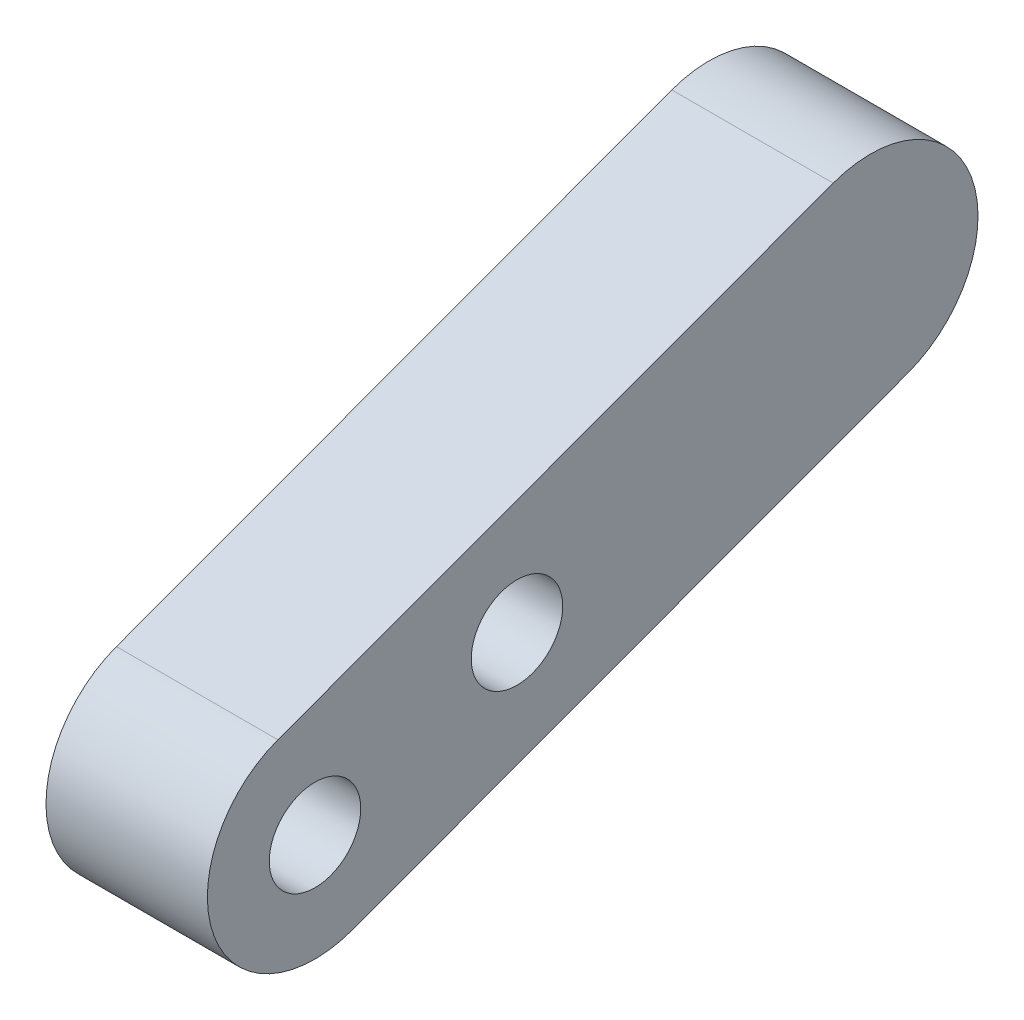
from build123d import *

# Parameters (mm, degrees)
SKETCH1_R           = 1.7
BOSS_EXTRUDE1_DEPTH = 6


with BuildPart() as part:
    # Sketch1 → Boss-Extrude1 (new body)
    with BuildSketch(Plane(origin=(0, 0, 0), x_dir=(0, 0, -1), z_dir=(1, 0, 0))):
        with BuildLine():
            Line((14.520034317, 1.08101962), (-6.126384754, -6.516702375))
            ThreePointArc((-6.126384754, -6.516702375), (-11.26168313, -4.144211997), (-8.889192752, 0.991086378))
            Line((-8.889192752, 0.991086378), (11.757226319, 8.588808374))
            ThreePointArc((11.757226319, 8.588808374), (16.892524695, 6.216317996), (14.520034317, 1.08101962))
        make_face()
        Circle(SKETCH1_R, mode=Mode.SUBTRACT)
        with Locations((-7.507788753, -2.762807998)):
            Circle(SKETCH1_R, mode=Mode.SUBTRACT)
    extrude(amount=-BOSS_EXTRUDE1_DEPTH)


solid = part.part
